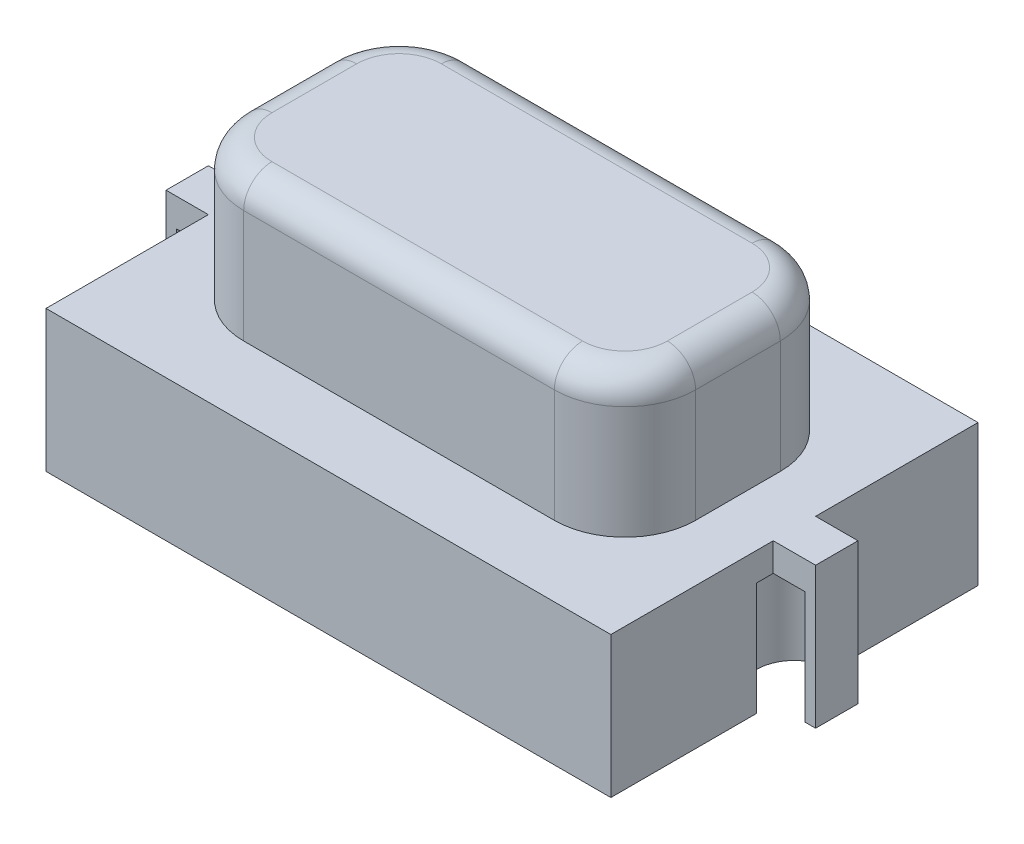
from build123d import *

# Parameters (mm, degrees)
BOSS_EXTRUDE1_DEPTH = 5
BOSS_EXTRUDE2_START = -5
SKETCH2_3_W         = 1.5
SKETCH2_3_H         = 1.5
BOSS_EXTRUDE2_DEPTH = 5
FILLET1_R           = 1
CUT_EXTRUDE1_START  = -5
SKETCH3_R           = 1.35
CUT_EXTRUDE1_DEPTH  = 4


with BuildPart() as part:
    # Sketch2 → Boss-Extrude1 (new body)
    with BuildSketch(Plane(origin=(0, 0, 0), x_dir=(1, 0, 0), z_dir=(0, 1, 0))):
        with BuildLine():
            ThreePointArc((-8, 1.5), (-7.267766953, 3.267766953), (-5.5, 4))
            Line((-5.5, 4), (5.5, 4))
            ThreePointArc((5.5, 4), (7.267766953, 3.267766953), (8, 1.5))
            Line((8, 1.5), (8, -1.5))
            ThreePointArc((8, -1.5), (7.267766953, -3.267766953), (5.5, -4))
            Line((5.5, -4), (-5.5, -4))
            ThreePointArc((-5.5, -4), (-7.267766953, -3.267766953), (-8, -1.5))
            Line((-8, -1.5), (-8, 1.5))
        make_face()
    extrude(amount=BOSS_EXTRUDE1_DEPTH)

    # Sketch2<3> → Boss-Extrude2 (add)
    # profile 1 of 4: a face of its own
    with BuildSketch(Plane(origin=(0, 0, 0), x_dir=(1, 0, 0), z_dir=(0, 1, 0)).offset(BOSS_EXTRUDE2_START)):
        Polygon((-10, 6.5), (-10, 0.75), (-10, -0.75), (-10, -6.5), (10, -6.5), (10, -0.75), (10, 0.75), (10, 6.5), align=None)
        with BuildLine():
            ThreePointArc((-8, 1.5), (-7.267766953, 3.267766953), (-5.5, 4))
            Line((-5.5, 4), (5.5, 4))
            ThreePointArc((5.5, 4), (7.267766953, 3.267766953), (8, 1.5))
            Line((8, 1.5), (8, -1.5))
            ThreePointArc((8, -1.5), (7.267766953, -3.267766953), (5.5, -4))
            Line((5.5, -4), (-5.5, -4))
            ThreePointArc((-5.5, -4), (-7.267766953, -3.267766953), (-8, -1.5))
            Line((-8, -1.5), (-8, 1.5))
        make_face(mode=Mode.SUBTRACT)
    # profile 2 of 4: a face of its own
    with BuildSketch(Plane(origin=(0, 0, 0), x_dir=(1, 0, 0), z_dir=(0, 1, 0)).offset(BOSS_EXTRUDE2_START)):
        with BuildLine():
            ThreePointArc((-8, 1.5), (-7.267766953, 3.267766953), (-5.5, 4))
            Line((-5.5, 4), (5.5, 4))
            ThreePointArc((5.5, 4), (7.267766953, 3.267766953), (8, 1.5))
            Line((8, 1.5), (8, -1.5))
            ThreePointArc((8, -1.5), (7.267766953, -3.267766953), (5.5, -4))
            Line((5.5, -4), (-5.5, -4))
            ThreePointArc((-5.5, -4), (-7.267766953, -3.267766953), (-8, -1.5))
            Line((-8, -1.5), (-8, 1.5))
        make_face()
    # profile 3 of 4: a face of its own
    with BuildSketch(Plane(origin=(0, 0, 0), x_dir=(1, 0, 0), z_dir=(0, 1, 0)).offset(BOSS_EXTRUDE2_START)):
        with Locations((10.75, 0)):
            Rectangle(SKETCH2_3_W, SKETCH2_3_H)
    # profile 4 of 4: a face of its own
    with BuildSketch(Plane(origin=(0, 0, 0), x_dir=(1, 0, 0), z_dir=(0, 1, 0)).offset(BOSS_EXTRUDE2_START)):
        with Locations((-10.75, 0)):
            Rectangle(SKETCH2_3_W, SKETCH2_3_H)
    extrude(amount=BOSS_EXTRUDE2_DEPTH)

    # Fillet1
    fillet1_edges = [part.edges().sort_by_distance(p)[0] for p in [
        (-8, 5, 0),
        (-7.267766953, 5, 3.267766953),
        (0, 5, 4),
        (7.267766953, 5, 3.267766953),
        (8, 5, 0),
        (7.267766953, 5, -3.267766953),
        (0, 5, -4),
        (-7.267766953, 5, -3.267766953),
    ]]
    fillet(fillet1_edges, radius=FILLET1_R)

    # Sketch3 → Cut-Extrude1 (cut)
    with BuildSketch(Plane(origin=(0, 0, 0), x_dir=(1, 0, 0), z_dir=(0, 1, 0)).offset(CUT_EXTRUDE1_START)):
        with Locations((10, 0)):
            Circle(SKETCH3_R)
        with Locations((-10, 0)):
            Circle(SKETCH3_R)
    extrude(amount=CUT_EXTRUDE1_DEPTH, mode=Mode.SUBTRACT)


solid = part.part
